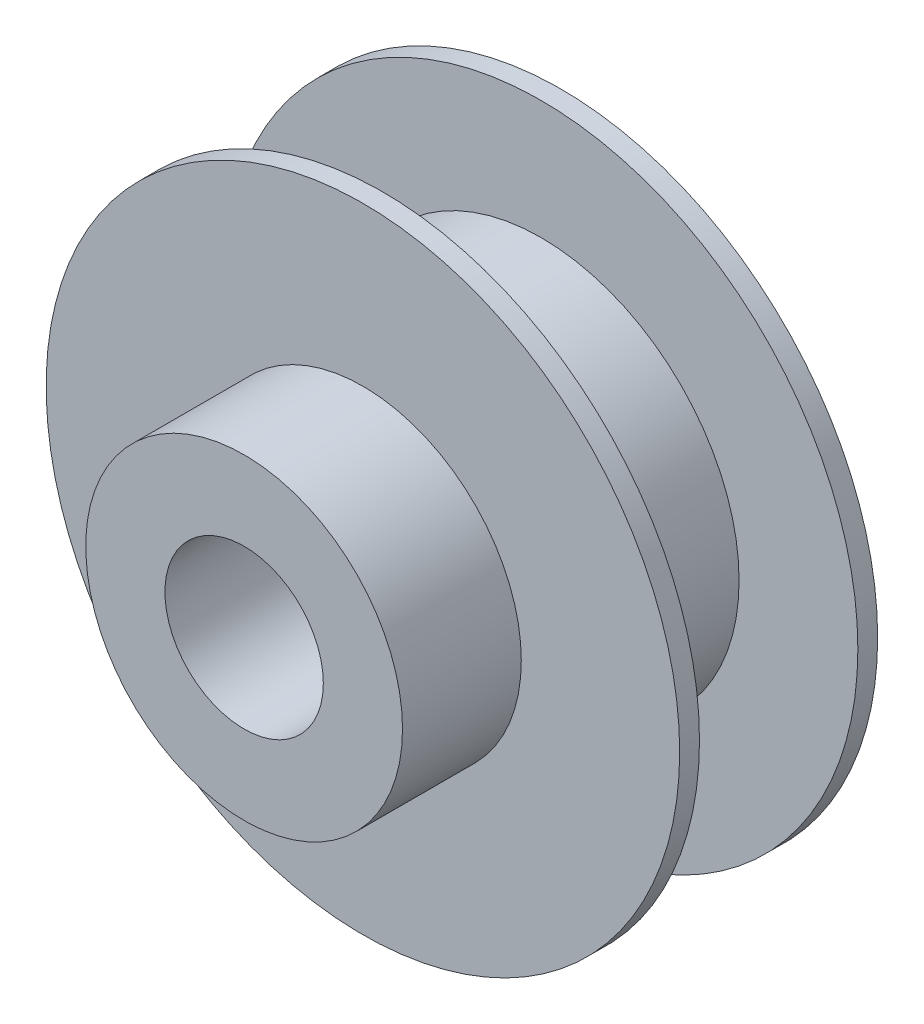
from build123d import *

# Parameters (mm, degrees)
ESQUISSE1_R             = 16
BOSS_EXTRU_1_DEPTH      = 10
ESQUISSE2_R             = 8
BOSS_EXTRU_2_DEPTH      = 6
ESQUISSE3_R             = 4
ENL_V_MAT_EXTRU_1_DEPTH = 28.712812921
ESQUISSE4_W             = 8
ESQUISSE4_H             = 6


with BuildPart() as part:
    # Esquisse1 → Boss.-Extru.1 (new body)
    with BuildSketch(Plane.XY):
        Circle(ESQUISSE1_R)
    extrude(amount=BOSS_EXTRU_1_DEPTH)

    # Esquisse2 → Boss.-Extru.2 (add)
    with BuildSketch(Plane.XY.offset(10)):
        Circle(ESQUISSE2_R)
    extrude(amount=BOSS_EXTRU_2_DEPTH)

    # Esquisse3 → Enlèv. mat.-Extru.1 (cut, through all)
    with BuildSketch(Plane.XY.offset(16)):
        Circle(ESQUISSE3_R)
    extrude(amount=-ENL_V_MAT_EXTRU_1_DEPTH, mode=Mode.SUBTRACT)

    # Esquisse4 → Enlèvement de matière-Révolution1 (revolve, cut)
    with BuildSketch(Plane(origin=(0, 0, 0), x_dir=(0, 0, -1), z_dir=(1, 0, 0)), mode=Mode.PRIVATE) as enl_vement_de_mati_re_r_volution1_sk:
        with Locations((-5, 13)):
            Rectangle(ESQUISSE4_W, ESQUISSE4_H)
    revolve(enl_vement_de_mati_re_r_volution1_sk.sketch.rotate(Axis((0, 0, 0), (0, 0, -1)), 90), axis=Axis((0, 0, 0), (0, 0, -1)), mode=Mode.SUBTRACT)


solid = part.part
